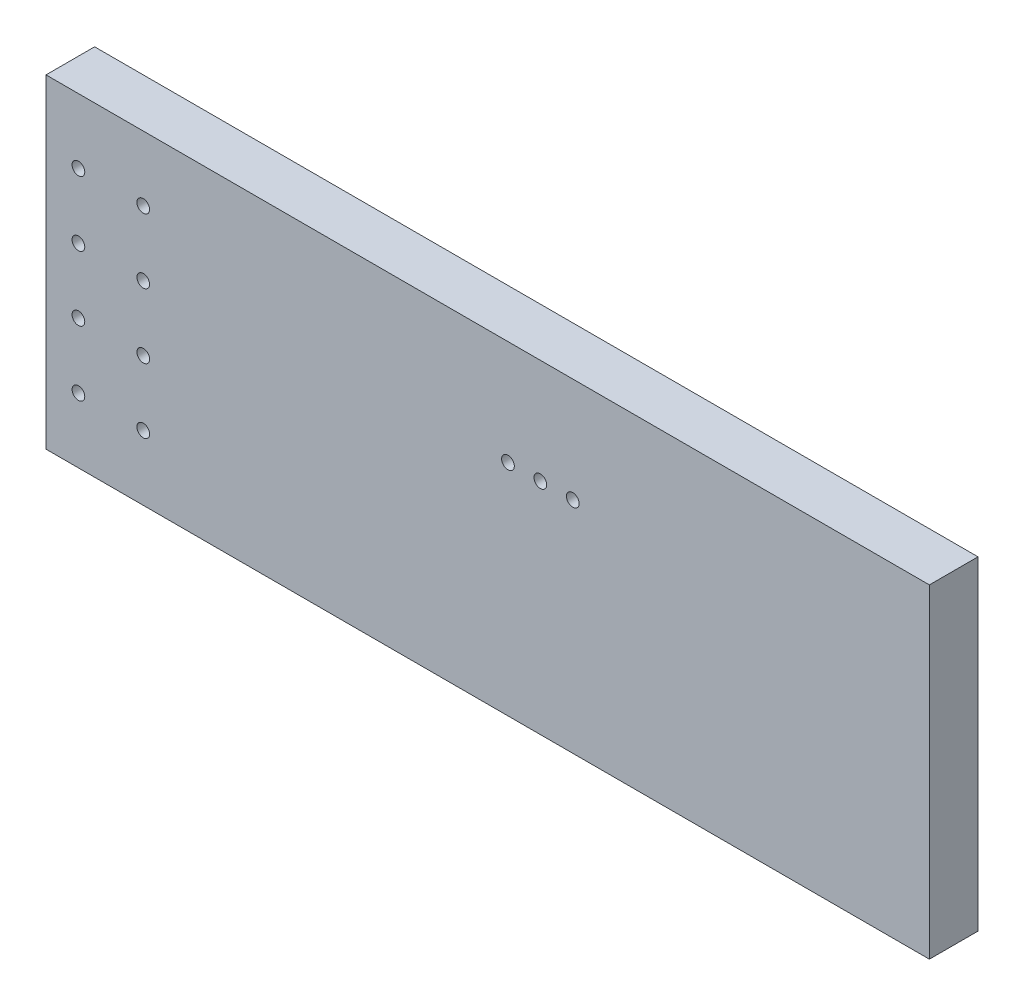
from build123d import *

# Parameters (mm, degrees)
SKETCH1_W           = 717.55
SKETCH1_H           = 127
BOSS_EXTRUDE1_DEPTH = 19.05
SKETCH2_R           = 2.4892
CUT_EXTRUDE1_DEPTH  = 25.4
SKETCH4_R           = 2.4892
CUT_EXTRUDE2_DEPTH  = 729.951236366
SKETCH5_W           = 371.475
SKETCH5_H           = 127
CUT_EXTRUDE3_DEPTH  = 729.951236366


with BuildPart() as part:
    # Sketch1 → Boss-Extrude1 (new body)
    with BuildSketch(Plane.XY):
        with Locations((358.775, 63.5)):
            Rectangle(SKETCH1_W, SKETCH1_H)
    extrude(amount=BOSS_EXTRUDE1_DEPTH)

    # Sketch2 → Cut-Extrude1 (cut)
    with BuildSketch(Plane.XY.offset(19.05)):
        with Locations((12.7, 101.6)):
            Circle(SKETCH2_R)
        with Locations((38.1, 101.6)):
            Circle(SKETCH2_R)
        with Locations((38.1, 76.2)):
            Circle(SKETCH2_R)
        with Locations((38.1, 50.8)):
            Circle(SKETCH2_R)
        with Locations((38.1, 25.4)):
            Circle(SKETCH2_R)
        with Locations((12.7, 76.2)):
            Circle(SKETCH2_R)
        with Locations((12.7, 50.8)):
            Circle(SKETCH2_R)
        with Locations((12.7, 25.4)):
            Circle(SKETCH2_R)
        with Locations((685.8, 101.6)):
            Circle(SKETCH2_R)
        with Locations((660.4, 101.6)):
            Circle(SKETCH2_R)
        with Locations((660.4, 76.2)):
            Circle(SKETCH2_R)
        with Locations((660.4, 50.8)):
            Circle(SKETCH2_R)
        with Locations((660.4, 25.4)):
            Circle(SKETCH2_R)
        with Locations((685.8, 76.2)):
            Circle(SKETCH2_R)
        with Locations((685.8, 50.8)):
            Circle(SKETCH2_R)
        with Locations((685.8, 25.4)):
            Circle(SKETCH2_R)
    extrude(amount=-CUT_EXTRUDE1_DEPTH, mode=Mode.SUBTRACT)

    # Sketch4 → Cut-Extrude2 (cut, through all)
    with BuildSketch(Plane.XY.offset(19.05)):
        with Locations((180.975, 85.979)):
            Circle(SKETCH4_R)
        with Locations((193.675, 85.979)):
            Circle(SKETCH4_R)
        with Locations((206.375, 85.979)):
            Circle(SKETCH4_R)
        with Locations((492.125, 85.979)):
            Circle(SKETCH4_R)
        with Locations((504.825, 85.979)):
            Circle(SKETCH4_R)
        with Locations((517.525, 85.979)):
            Circle(SKETCH4_R)
    extrude(amount=-CUT_EXTRUDE2_DEPTH, mode=Mode.SUBTRACT)

    # Sketch5 → Cut-Extrude3 (cut, through all)
    with BuildSketch(Plane.XY.offset(19.05)):
        with Locations((531.8125, 63.5)):
            Rectangle(SKETCH5_W, SKETCH5_H)
    extrude(amount=-CUT_EXTRUDE3_DEPTH, mode=Mode.SUBTRACT)


solid = part.part
